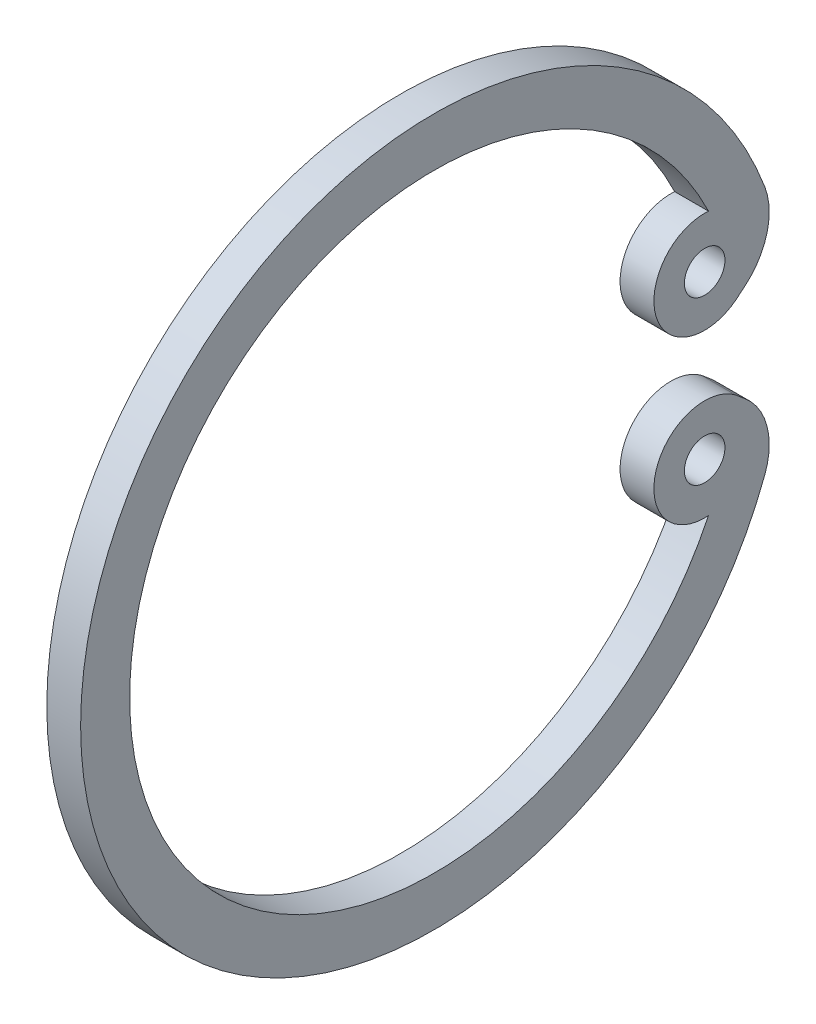
from build123d import *

# Parameters (mm, degrees)
SKETCH1_R           = 0.6
BOSS_EXTRUDE1_DEPTH = 1
SCALE1_SCALE        = 0.555555556


with BuildPart() as part:
    # Sketch1 → Boss-Extrude1 (new body)
    with BuildSketch(Plane(origin=(19, 0, 0), x_dir=(0, 0, -1), z_dir=(1, 0, 0))):
        with BuildLine():
            Line((-1.082906578, 1.214226965), (-0.806260325, 1.444819657))
            ThreePointArc((-0.806260325, 1.444819657), (-0.157167996, 2.46989624), (-0.220083072, 3.681566388))
            ThreePointArc((-0.220083072, 3.681566388), (-20.449170804, -0.000103807), (-0.220095755, -3.681843689))
            ThreePointArc((-0.220095755, -3.681843689), (-0.157177378, -2.470170425), (-0.806270581, -1.44509051))
            Line((-0.806270581, -1.44509051), (-1.082193901, -1.213563353))
            ThreePointArc((-1.082193901, -1.213563353), (-3.437745717, -1.969386585), (-1.886859109, -3.896727719))
            ThreePointArc((-1.886859109, -3.896727719), (-18.999593972, -0.000121806), (-1.886859109, 3.896484108))
            ThreePointArc((-1.886859109, 3.896484108), (-3.437385157, 1.97013231), (-1.082906578, 1.214226965))
        make_face()
        with Locations(Location((-2.00000003, -2.4, 0), (0, 0, 180))):
            Circle(SKETCH1_R, mode=Mode.SUBTRACT)
        with Locations(Location((-2.00000003, 2.4, 0), (0, 0, 180))):
            Circle(SKETCH1_R, mode=Mode.SUBTRACT)
    extrude(amount=-BOSS_EXTRUDE1_DEPTH)


with BuildPart() as part_1:
    # Scale1: scaled about (18.5, -0.000178585, 9.916688181)
    add(part.part.scale(SCALE1_SCALE).moved(Location((8.222222222, -7.9371e-05, 4.407416969))))


solid = part_1.part
